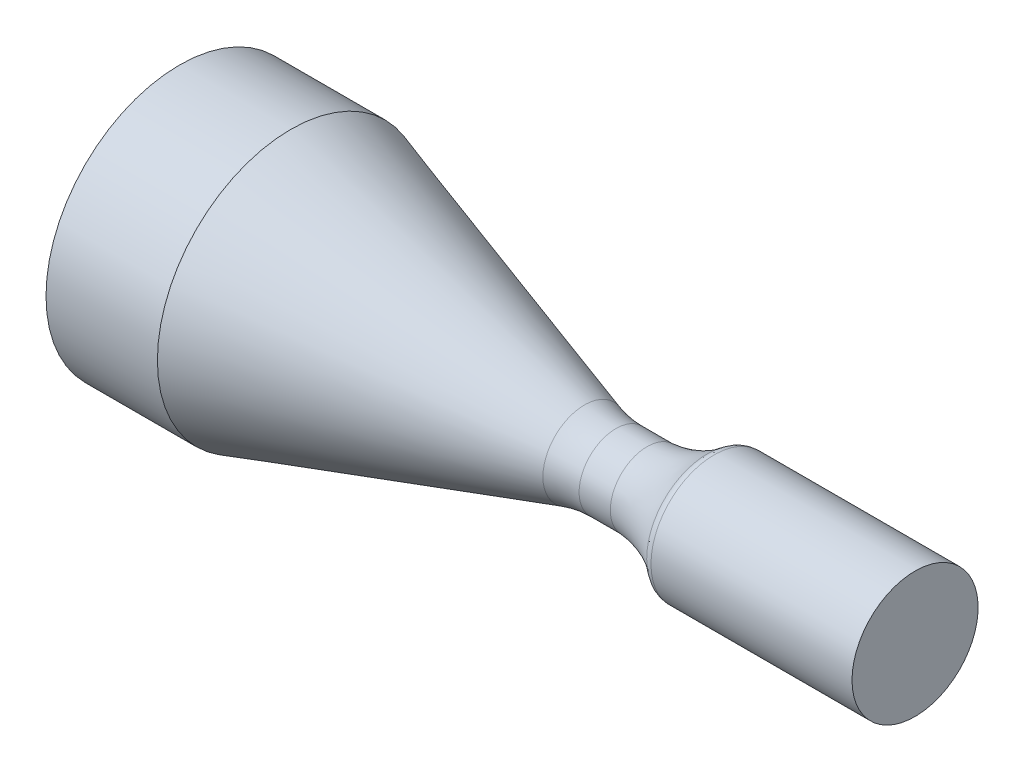
from build123d import *


with BuildPart() as part:
    # Sketch1 → Revolve1 (revolve)
    with BuildSketch(Plane(origin=(0, 0, 0), x_dir=(1, 0, 0), z_dir=(0, 1, 0)), mode=Mode.PRIVATE) as revolve1_sk:
        with BuildLine():
            Line((200, 0), (200, 127))
            Line((200, 127), (306, 127))
            Line((306, 127), (585.416444947, 39.563561445))
            ThreePointArc((585.416444947, 39.563561445), (600.17534443, 36.147473842), (615.280908712, 35))
            Line((615.280908712, 35), (645, 35))
            ThreePointArc((645, 35), (675.456211488, 41.825909834), (702.324557443, 57.708788945))
            ThreePointArc((702.324557443, 57.708788945), (705.309695294, 59.409779207), (708.694374787, 60))
            Line((708.694374787, 60), (900, 60))
            Line((900, 60), (900, 0))
            Line((900, 0), (200, 0))
        make_face()
    revolve(revolve1_sk.sketch.rotate(Axis((0, 0, 0), (1, 0, 0)), 180), axis=Axis((0, 0, 0), (1, 0, 0)))


solid = part.part
